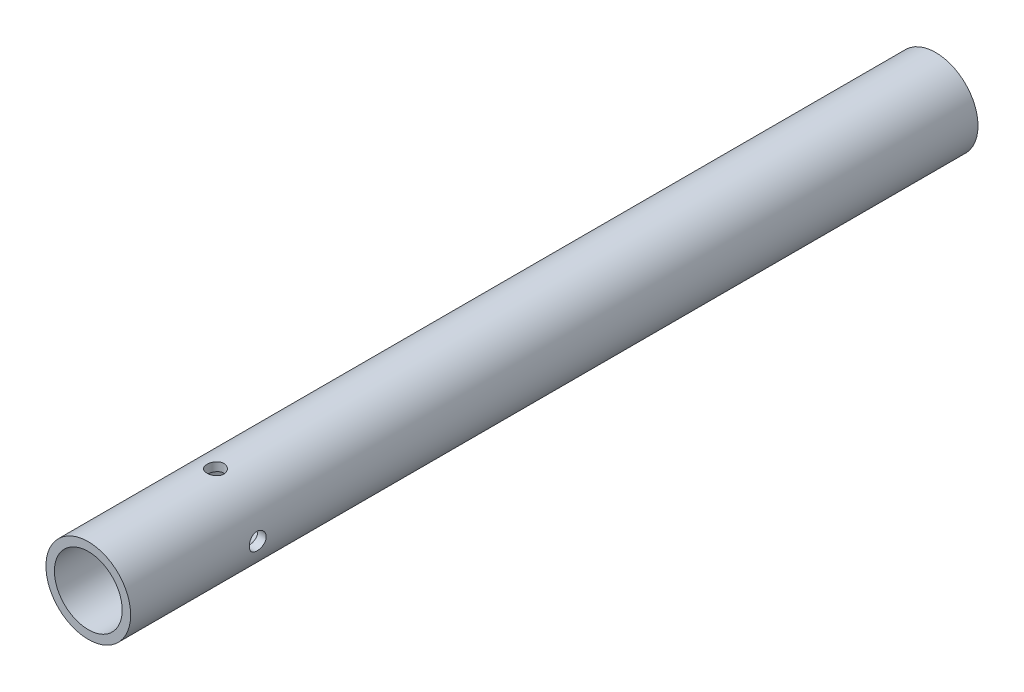
from build123d import *

# Parameters (mm, degrees)
SKETCH1_R               = 500
SKETCH1_R_2             = 400
BOSS_EXTRUDE1_DEPTH     = 10000
CUT_EXTRUDE1_DEPTH      = 10025.968827882
CUT_EXTRUDE1_DEPTH_BACK = 10025.968827882
SKETCH2_R               = 100
CUT_EXTRUDE2_DEPTH      = 10025.968827991
CUT_EXTRUDE2_DEPTH_BACK = 10025.968827991
SKETCH3_R               = 100


with BuildPart() as part:
    # Sketch1 → Boss-Extrude1 (new body)
    with BuildSketch(Plane.XY):
        Circle(SKETCH1_R)
        Circle(SKETCH1_R_2, mode=Mode.SUBTRACT)
    extrude(amount=BOSS_EXTRUDE1_DEPTH)

    # Sketch2 → Cut-Extrude1 (cut, two sides: drawn at the far end of the back side and taken through both)
    with BuildSketch(Plane(origin=(0, 0, 0), x_dir=(1, 0, 0), z_dir=(0, 1, 0)).offset(-CUT_EXTRUDE1_DEPTH_BACK)):
        with Locations(Location((0, -8500, 0), (0, 0, 270))):
            Circle(SKETCH2_R)
    extrude(amount=CUT_EXTRUDE1_DEPTH + CUT_EXTRUDE1_DEPTH_BACK, mode=Mode.SUBTRACT)

    # Sketch3 → Cut-Extrude2 (cut, two sides: drawn at the far end of the back side and taken through both)
    with BuildSketch(Plane(origin=(0, 0, 0), x_dir=(0, 0, -1), z_dir=(1, 0, 0)).offset(-CUT_EXTRUDE2_DEPTH_BACK)):
        with Locations((-8500, 0)):
            Circle(SKETCH3_R)
    extrude(amount=CUT_EXTRUDE2_DEPTH + CUT_EXTRUDE2_DEPTH_BACK, mode=Mode.SUBTRACT)


solid = part.part
